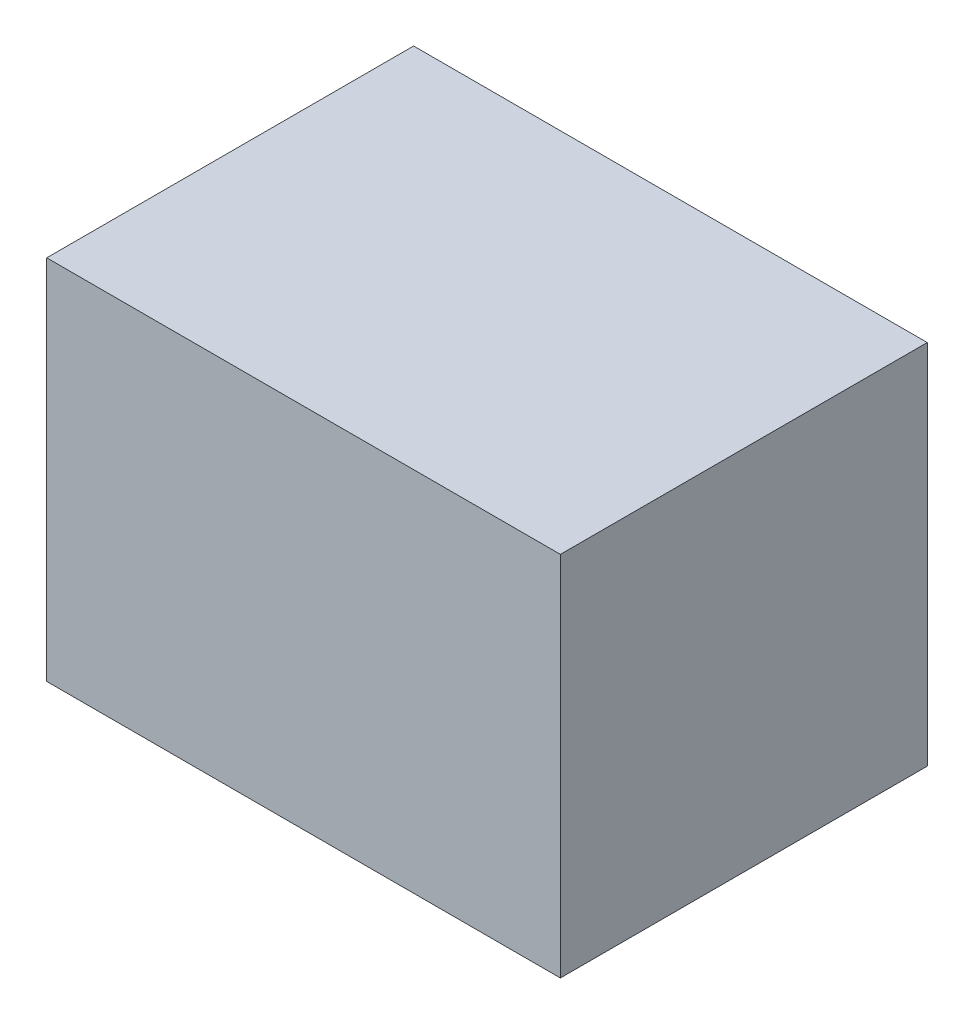
from build123d import *

# Parameters (mm, degrees)
SKETCH1_W           = 63.5
SKETCH1_H           = 63.5
BOSS_EXTRUDE1_DEPTH = 88.9
SKETCH2_R           = 3
BOSS_EXTRUDE2_DEPTH = 22.225


with BuildPart() as part:
    # Sketch1 → Boss-Extrude1 (new body)
    with BuildSketch(Plane(origin=(0, 0, 0), x_dir=(0, 0, -1), z_dir=(1, 0, 0))):
        Rectangle(SKETCH1_W, SKETCH1_H)
    extrude(amount=BOSS_EXTRUDE1_DEPTH)

    # Sketch2 → Boss-Extrude2 (add)
    with BuildSketch(Plane.ZY):
        with Locations(Location((0, 0, 0), (0, 0, 180))):
            Circle(SKETCH2_R)
    extrude(amount=BOSS_EXTRUDE2_DEPTH)


solid = part.part
